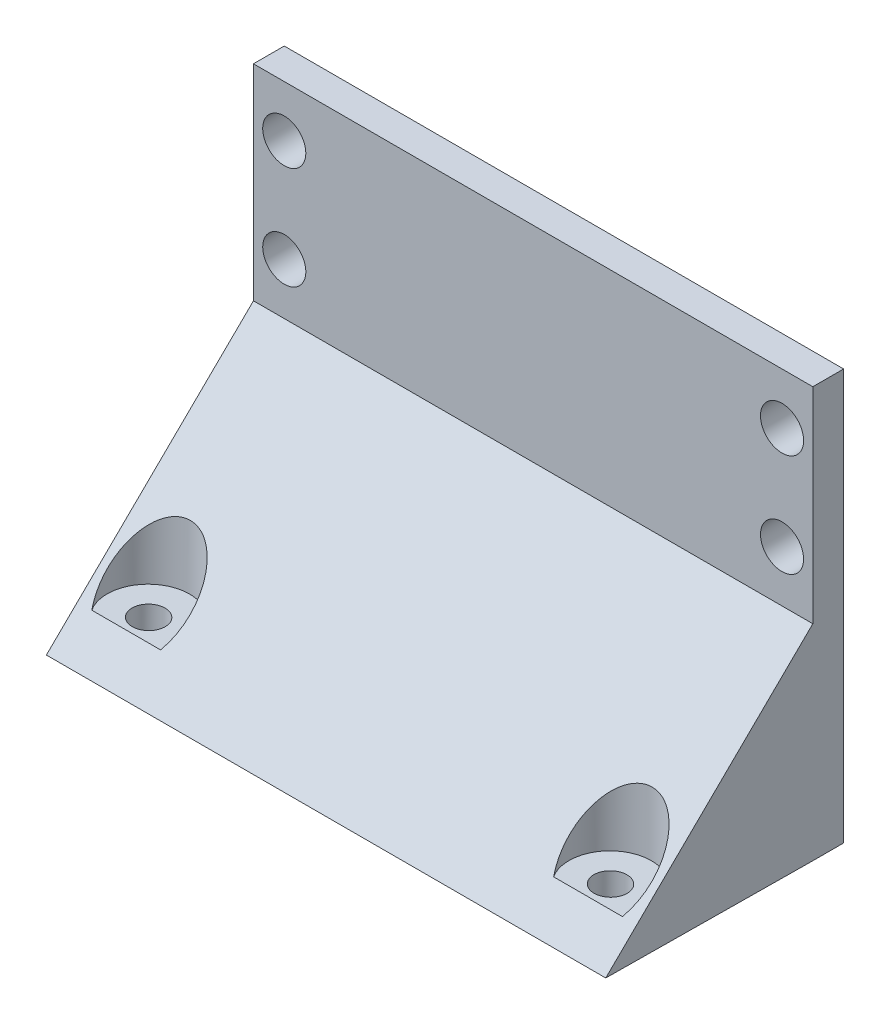
from build123d import *

# Parameters (mm, degrees)
SKETCH_1_W          = 54.5
SKETCH_1_H          = 40
SKETCH_1_R          = 2.1
EXTRUDE_1_DEPTH     = 3
EXTRUDE_2_DEPTH     = 54.5
SKETCH_3_R          = 1.5
SKETCH_3_R_2        = 1.6
CUT_EXTRUDE_1_DEPTH = 8
CUT_EXTRUDE_START   = -10
SKETCH_4_R          = 4
CUT_EXTRUDE_2_DEPTH = 7


with BuildPart() as part:
    # 草图1 → 凸台-拉伸1 (new body)
    with BuildSketch(Plane.XY):
        with Locations((0, -20)):
            Rectangle(SKETCH_1_W, SKETCH_1_H)
        with Locations((-24.25, -5)):
            Circle(SKETCH_1_R, mode=Mode.SUBTRACT)
        with Locations(Location((24.25, -5, 0), (0, 0, 180))):
            Circle(SKETCH_1_R, mode=Mode.SUBTRACT)
        with Locations((24.25, -15)):
            Circle(SKETCH_1_R, mode=Mode.SUBTRACT)
        with Locations(Location((-24.25, -15, 0), (0, 0, 180))):
            Circle(SKETCH_1_R, mode=Mode.SUBTRACT)
    extrude(amount=EXTRUDE_1_DEPTH)

    # 草图2 → 凸台-拉伸2 (add)
    with BuildSketch(Plane.ZY.offset(27.25)):
        Polygon((3, -20), (23.176339002, -39.802940776), (3, -40), align=None)
    extrude(amount=-EXTRUDE_2_DEPTH)

    # 草图3 → 切除-拉伸1 (cut)
    with BuildSketch(Plane(origin=(0, -40.025482459, 0.390922779), x_dir=(1, 0, 0), z_dir=(0, -0.9999523077580083, 0.009766381593687423))):
        with Locations(Location((-22.5, 2.602610467, 0), (0, 0, 270))):
            Circle(SKETCH_3_R)
        with Locations(Location((-22.5, 17.602610467, 0), (0, 0, 270))):
            Circle(SKETCH_3_R_2)
        with Locations(Location((22.5, 17.602610467, 0), (0, 0, 270))):
            Circle(SKETCH_3_R_2)
        with Locations(Location((22.5, 2.602610467, 0), (0, 0, 270))):
            Circle(SKETCH_3_R)
    extrude(amount=-CUT_EXTRUDE_1_DEPTH, mode=Mode.SUBTRACT)

    # 草图4 → 切除-拉伸2 (cut)
    with BuildSketch(Plane(origin=(0, -40.025482459, 0.390922779), x_dir=(1, 0, 0), z_dir=(0, -0.9999523077580083, 0.009766381593687423)).offset(CUT_EXTRUDE_START)):
        with Locations((-22.5, 17.602610467)):
            Circle(SKETCH_4_R)
        with Locations((22.5, 17.602610467)):
            Circle(SKETCH_4_R)
    extrude(amount=CUT_EXTRUDE_2_DEPTH, mode=Mode.SUBTRACT)


solid = part.part
